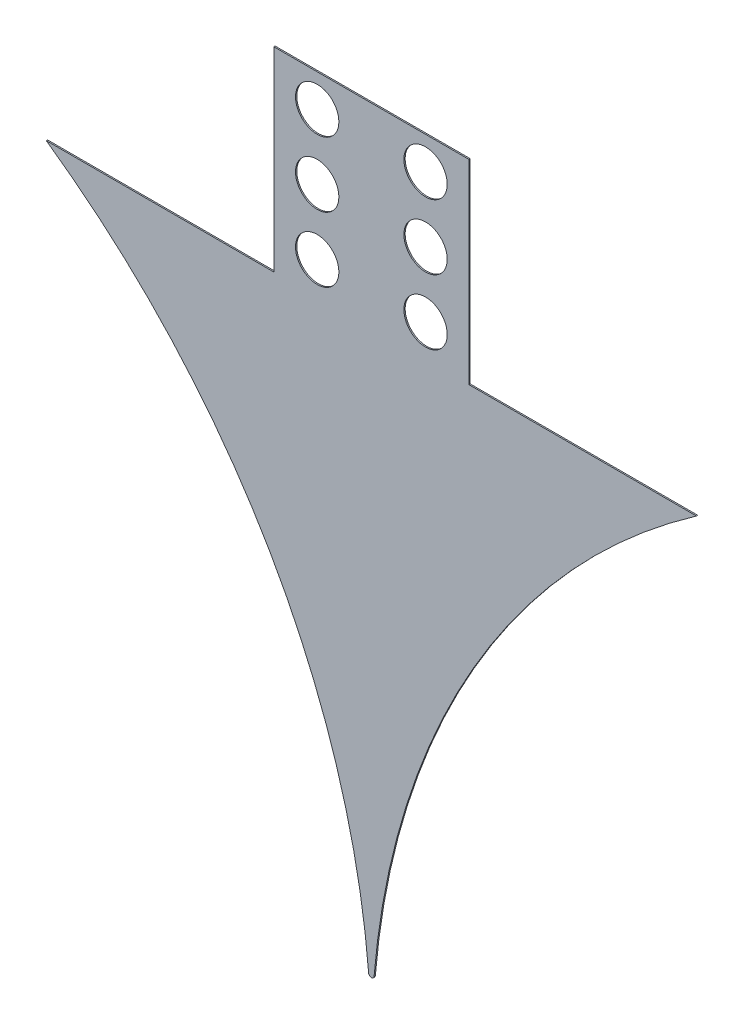
from build123d import *
from OCP.BRepFilletAPI import BRepFilletAPI_MakeChamfer

# Parameters (mm, degrees)
SKETCH2_R           = 1.5875
BOSS_EXTRUDE1_DEPTH = 0.118
SKETCH3_R           = 2
CUT_EXTRUDE1_DEPTH  = 267.27056526
CHAMFER1_SIZE       = 20
CHAMFER1_SIZE2      = 24.415491775
SKETCH4_W           = 440.908945527
SKETCH4_H           = 173.352966469
CUT_EXTRUDE4_DEPTH  = 251.000027848
SKETCH5_W           = 18
SKETCH5_H           = 18
SKETCH5_R           = 2
BOSS_EXTRUDE2_DEPTH = 0.118
FILLET1_R           = 0.25


with BuildPart() as part:
    # Sketch2 → Boss-Extrude1 (new body)
    with BuildSketch(Plane.XY):
        with BuildLine():
            Line((99.563224144, -21.926473835), (48.69, -83.15))
            ThreePointArc((48.69, -83.15), (13.462751156, -108.648946204), (0, -150))
            ThreePointArc((0, -150), (-13.462751156, -108.648946204), (-48.69, -83.15))
            Line((-48.69, -83.15), (-99.563224144, -21.926473835))
            Line((-99.563224144, -21.926473835), (-140, -21.926473835))
            ThreePointArc((-140, -21.926473835), (-145.965681261, -3.736597624), (-158.952536164, 10.327631798))
            Line((-158.952536164, 10.327631798), (-220, 53.073526165))
            Line((-220, 53.073526165), (-67, 53.073526165))
            ThreePointArc((-67, 53.073526165), (-51.137889855, 23.094319589), (-17.95554779, 16.073526165))
            Line((-17.95554779, 16.073526165), (-15.117733438, 43.073526165))
            Line((-15.117733438, 43.073526165), (-12, 30.568980335))
            ThreePointArc((-12, 30.568980335), (0, 33.073526165), (12, 30.568980335))
            Line((12, 30.568980335), (15.117733438, 43.073526165))
            Line((15.117733438, 43.073526165), (17.95554779, 16.073526165))
            ThreePointArc((17.95554779, 16.073526165), (51.137889855, 23.094319589), (67, 53.073526165))
            Line((67, 53.073526165), (220, 53.073526165))
            Line((220, 53.073526165), (158.952536164, 10.327631798))
            ThreePointArc((158.952536164, 10.327631798), (145.965681261, -3.736597624), (140, -21.926473835))
            Line((140, -21.926473835), (99.563224144, -21.926473835))
        make_face()
        with Locations((46.19, 13)):
            Circle(SKETCH2_R, mode=Mode.SUBTRACT)
        with Locations((-46.19, 13)):
            Circle(SKETCH2_R, mode=Mode.SUBTRACT)
        with Locations((46.19, -80.65)):
            Circle(SKETCH2_R, mode=Mode.SUBTRACT)
        with Locations((-46.19, -80.65)):
            Circle(SKETCH2_R, mode=Mode.SUBTRACT)
    extrude(amount=BOSS_EXTRUDE1_DEPTH)

    # Sketch3 → Cut-Extrude1 (cut, through all)
    with BuildSketch(Plane(origin=(0, 0, 0), x_dir=(-1, 0, 0), z_dir=(0, 0, -1))):
        with Locations((165, 49.573526165)):
            Circle(SKETCH3_R)
        with Locations((165, 19.573526165)):
            Circle(SKETCH3_R)
        with Locations((150, 34.573526165)):
            Circle(SKETCH3_R)
    cut_extrude1 = extrude(amount=-CUT_EXTRUDE1_DEPTH, mode=Mode.SUBTRACT)

    # Mirror2: Cut-Extrude1 across plane
    add(cut_extrude1.mirror(Plane(origin=(0, 0, 0), x_dir=(0, 0, 1), z_dir=(1, 0, 0))), mode=Mode.SUBTRACT)

    # Chamfer1: one chamfer whose edges measure the first distance from different faces: ONE call of the kernel's chamfer builder (chamfer() names one face for all edges)
    chamfer1_edges_1 = [part.edges().sort_by_distance(p)[0] for p in [
        (220, 53.073526165, 0.059),
    ]]
    chamfer1_side_1 = [part.faces().sort_by_distance(p)[0] for p in [
        (143.5, 53.073526165, 0.059),
    ]]
    chamfer1_edges_2 = [part.edges().sort_by_distance(p)[0] for p in [
        (-220, 53.073526165, 0.059),
    ]]
    chamfer1_side_2 = [part.faces().sort_by_distance(p)[0] for p in [
        (-143.5, 53.073526165, 0.059),
    ]]
    chamfer1 = BRepFilletAPI_MakeChamfer(part.part.solid().wrapped)
    for e in chamfer1_edges_1:
        chamfer1.Add(CHAMFER1_SIZE, CHAMFER1_SIZE2, e.wrapped, chamfer1_side_1[0].wrapped)  # the first distance lies on this face
    for e in chamfer1_edges_2:
        chamfer1.Add(CHAMFER1_SIZE, CHAMFER1_SIZE2, e.wrapped, chamfer1_side_2[0].wrapped)  # the first distance lies on this face
    add(Compound.cast(chamfer1.Shape()), mode=Mode.REPLACE)

    # Sketch4 → Cut-Extrude4 (cut, through all)
    with BuildSketch(Plane(origin=(0, 0, 0), x_dir=(-1, 0, 0), z_dir=(0, 0, -1))):
        with Locations((-5.514300507, -5.754470648)):
            Rectangle(SKETCH4_W, SKETCH4_H)
    extrude(amount=-CUT_EXTRUDE4_DEPTH, mode=Mode.SUBTRACT)

    # Sketch5 → Boss-Extrude2 (add)
    with BuildSketch(Plane(origin=(0, 0, 0), x_dir=(-1, 0, 0), z_dir=(0, 0, -1))):
        with Locations((0, -83.430953883)):
            Rectangle(SKETCH5_W, SKETCH5_H)
        with Locations((-5, -89.430953883)):
            Circle(SKETCH5_R, mode=Mode.SUBTRACT)
        with Locations((5, -89.430953883)):
            Circle(SKETCH5_R, mode=Mode.SUBTRACT)
        with Locations((-5, -83.430953883)):
            Circle(SKETCH5_R, mode=Mode.SUBTRACT)
        with Locations((5, -83.430953883)):
            Circle(SKETCH5_R, mode=Mode.SUBTRACT)
        with Locations((-5, -77.430953883)):
            Circle(SKETCH5_R, mode=Mode.SUBTRACT)
        with Locations((5, -77.430953883)):
            Circle(SKETCH5_R, mode=Mode.SUBTRACT)
    extrude(amount=-BOSS_EXTRUDE2_DEPTH)

    # Fillet1
    fillet1_edges = [part.edges().sort_by_distance(p)[0] for p in [
        (0, -150, 0.059),
    ]]
    fillet(fillet1_edges, radius=FILLET1_R)


solid = part.part
